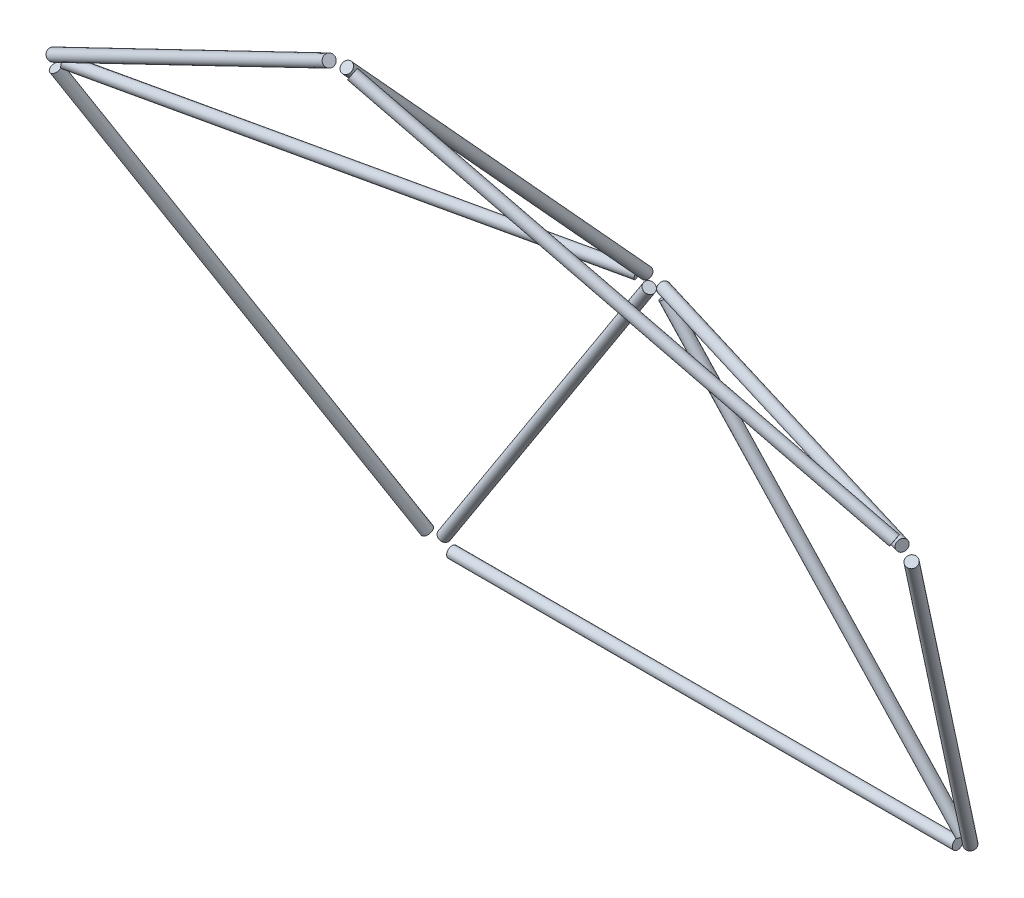
from build123d import *

# Parameters (mm, degrees)
SKETCH20_R        = 1.5
SKETCH21_R        = 1.5
CIRPATTERN7_COUNT = 5
CIRPATTERN8_COUNT = 5


with BuildPart() as part:
    # Sweep4: sweep along a path in Sketch16
    with BuildLine(Plane(origin=(71.35154116, 74.813981292, -201.467891676), x_dir=(-0.9490605003608429, 0.10968961318168566, -0.2953850968056427), z_dir=(0.3150939013291542, 0.3303843036360469, -0.8896977269028498))) as sweep4_path:
        Line((72.798191909, 22.677431961), (-0.580452741, -76.246349028))
    # Sketch20 → Sweep4 (sweep)
    with BuildSketch(Plane(origin=(2.261652721, 104.058168353, -215.076988054), x_dir=(-0.8248078173251137, -0.5609339440894788, -0.07102939425057496), z_dir=(0.5654131803198278, -0.8182736416337228, -0.10361555350478845))):
        Circle(SKETCH20_R)
    sweep(path=sweep4_path.line)


with BuildPart() as body_2:
    # Sweep5: sweep along a path in Sketch6
    with BuildLine(Plane(origin=(0, 91.301425564, -182.602851129), x_dir=(-1, 0, 0), z_dir=(0, 0.44721359549995754, -0.8944271909999162))) as sweep5_path:
        Line((-118.763932023, 35.186137483), (-75.400146627, -98.273870937))
    # Sketch21 → Sweep5 (sweep)
    with BuildSketch(Plane(origin=(75.400146627, 3.402603233, -226.552262294), x_dir=(-0.9510565162951541, 0.2763932022500199, 0.1381966011250097), z_dir=(-0.309016994374946, -0.8506508083520407, -0.42532540417601955))):
        Circle(SKETCH21_R)
    sweep(path=sweep5_path.line)


with BuildPart() as cirpattern7_1:
    # CirPattern7: pattern copy
    add(part.part.rotate(Axis((0, 91.301425564, -182.602851129), (1.3257972884873299e-15, 0.4472135954999564, -0.8944271909999166)), 1 * 360 / CIRPATTERN7_COUNT))


with BuildPart() as cirpattern7_2:
    # CirPattern7: pattern copy
    add(part.part.rotate(Axis((0, 91.301425564, -182.602851129), (1.3257972884873299e-15, 0.4472135954999564, -0.8944271909999166)), 2 * 360 / CIRPATTERN7_COUNT))


with BuildPart() as cirpattern7_3:
    # CirPattern7: pattern copy
    add(part.part.rotate(Axis((0, 91.301425564, -182.602851129), (1.3257972884873299e-15, 0.4472135954999564, -0.8944271909999166)), 3 * 360 / CIRPATTERN7_COUNT))


with BuildPart() as cirpattern7_4:
    # CirPattern7: pattern copy
    add(part.part.rotate(Axis((0, 91.301425564, -182.602851129), (1.3257972884873299e-15, 0.4472135954999564, -0.8944271909999166)), 4 * 360 / CIRPATTERN7_COUNT))


with BuildPart() as cirpattern8_1:
    # CirPattern8: pattern copy
    add(body_2.part.rotate(Axis((0, 0, 0), (2.0136918097557567e-15, 0.4472135954999567, -0.8944271909999165)), 1 * 360 / CIRPATTERN8_COUNT))


with BuildPart() as cirpattern8_2:
    # CirPattern8: pattern copy
    add(body_2.part.rotate(Axis((0, 0, 0), (2.0136918097557567e-15, 0.4472135954999567, -0.8944271909999165)), 2 * 360 / CIRPATTERN8_COUNT))


with BuildPart() as cirpattern8_3:
    # CirPattern8: pattern copy
    add(body_2.part.rotate(Axis((0, 0, 0), (2.0136918097557567e-15, 0.4472135954999567, -0.8944271909999165)), 3 * 360 / CIRPATTERN8_COUNT))


with BuildPart() as cirpattern8_4:
    # CirPattern8: pattern copy
    add(body_2.part.rotate(Axis((0, 0, 0), (2.0136918097557567e-15, 0.4472135954999567, -0.8944271909999165)), 4 * 360 / CIRPATTERN8_COUNT))


solid = Compound([part.part, body_2.part, cirpattern7_1.part, cirpattern7_2.part, cirpattern7_3.part, cirpattern7_4.part, cirpattern8_1.part, cirpattern8_2.part, cirpattern8_3.part, cirpattern8_4.part])
